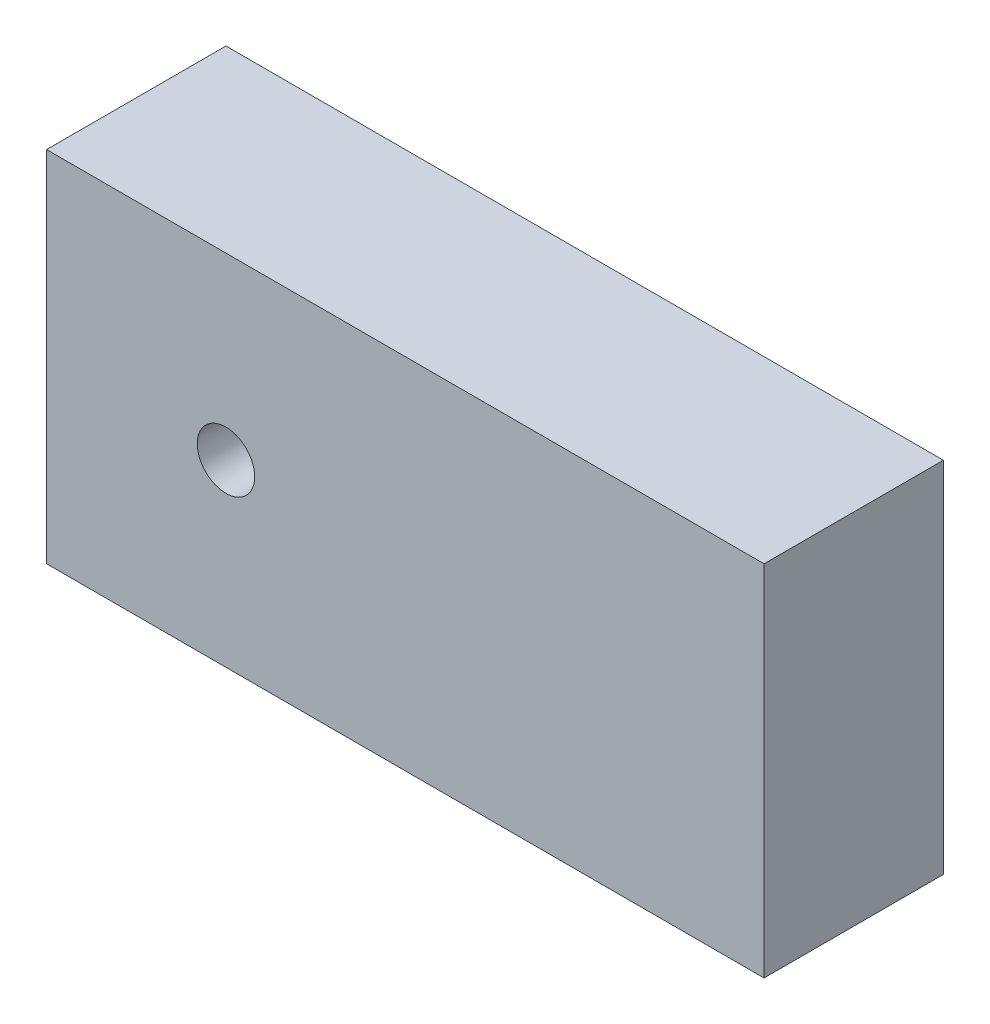
from build123d import *

# Parameters (mm, degrees)
SKETCH_1_W      = 40
SKETCH_1_H      = 20
SKETCH_1_R      = 1.6
EXTRUDE_1_DEPTH = 10


with BuildPart() as part:
    # 草图1 → 凸台-拉伸1 (new body)
    with BuildSketch(Plane.XY):
        with Locations((20, 10)):
            Rectangle(SKETCH_1_W, SKETCH_1_H)
        with Locations((10, 10)):
            Circle(SKETCH_1_R, mode=Mode.SUBTRACT)
    extrude(amount=EXTRUDE_1_DEPTH)


solid = part.part
